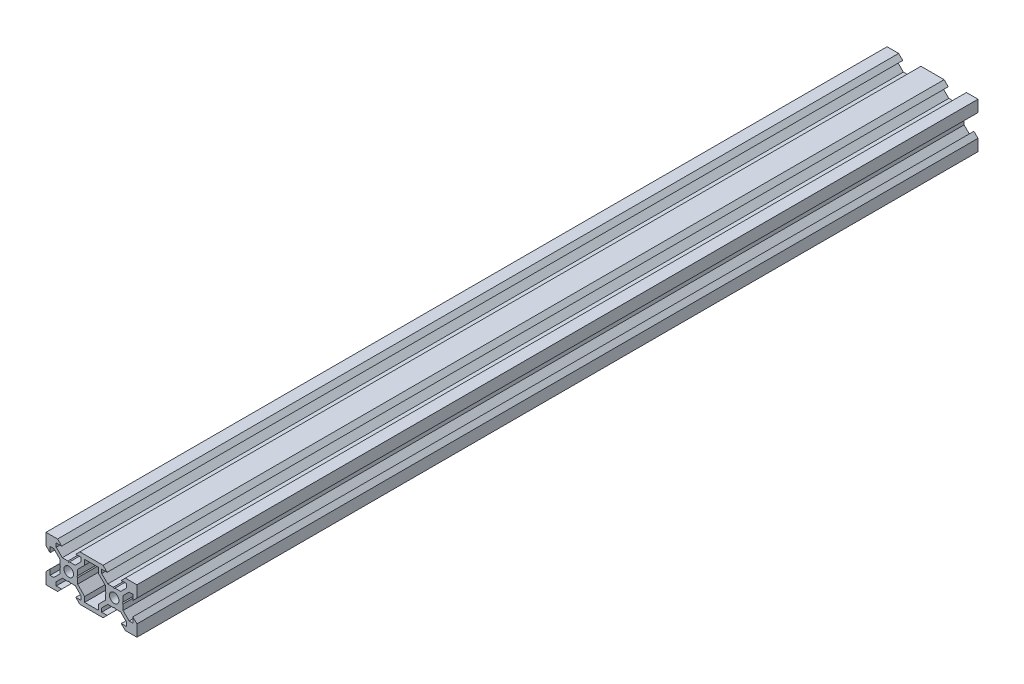
from build123d import *

# Parameters (mm, degrees)
SKETCH_1_W               = 40
SKETCH_1_H               = 20
EXTRUDE_1_DEPTH          = 370
SKETCH_2_R               = 2.1
CUT_EXTRUDE_1_DEPTH      = 371.675059857
CUT_EXTRUDE_2_DEPTH      = 371.675059857
PATTERN_CIRCULAR_1_COUNT = 4
MIRROR_1_COPY_1_DEPTH    = 371.675059857
MIRROR_1_COPY_2_DEPTH    = 371.675059857
MIRROR_1_COPY_3_DEPTH    = 371.675059857
CUT_EXTRUDE_3_DEPTH      = 371.675059857


with BuildPart() as part:
    # 草图1 → 凸台-拉伸1 (new body)
    with BuildSketch(Plane.XY):
        Rectangle(SKETCH_1_W, SKETCH_1_H)
    extrude(amount=-EXTRUDE_1_DEPTH)

    # 草图2 → 切除-拉伸1 (cut, through all)
    with BuildSketch(Plane.XY):
        with Locations((-10, 0)):
            Circle(SKETCH_2_R)
        with Locations(Location((10, 0, 0), (0, 0, 180))):
            Circle(SKETCH_2_R)
    extrude(amount=-CUT_EXTRUDE_1_DEPTH, mode=Mode.SUBTRACT)

    # 草图3 → 切除-拉伸2 (cut, through all)
    with BuildSketch(Plane.XY):
        Polygon((16.56, 5.499339828), (13.900660172, 2.84), (13.900660172, 0.353553391), (13.547106781, 0), (13.900660172, -0.353553391), (13.900660172, -2.84), (16.56, -5.499339828), (18.2, -5.499339828), (18.2, -3.1), (20, -4.9), (20, 4.9), (18.2, 3.1), (18.2, 5.499339828), align=None)
    cut_extrude_2 = extrude(amount=-CUT_EXTRUDE_2_DEPTH, mode=Mode.SUBTRACT)

    # 阵列(圆周)1: 切除-拉伸2 ×4 about axis
    pattern_circular_1_axis = Axis((10, 0, 0), (0, 0, 1))
    for i in range(1, PATTERN_CIRCULAR_1_COUNT):
        add(cut_extrude_2.rotate(pattern_circular_1_axis, i * 360 / PATTERN_CIRCULAR_1_COUNT), mode=Mode.SUBTRACT)

    # 镜向1: 切除-拉伸2 across plane
    add(cut_extrude_2.mirror(Plane(origin=(0, 0, 0), x_dir=(0, 0, 1), z_dir=(1, 0, 0))), mode=Mode.SUBTRACT)

    # 镜向1 copy 1 sketch → 镜向1 copy 1 (cut, through all)
    with BuildSketch(Plane(origin=(-10, -10, 0), x_dir=(0, 1, 0), z_dir=(0, 0, 1))):
        Polygon((16.56, -5.499339828), (13.900660172, -2.84), (13.900660172, -0.353553391), (13.547106781, 0), (13.900660172, 0.353553391), (13.900660172, 2.84), (16.56, 5.499339828), (18.2, 5.499339828), (18.2, 3.1), (20, 4.9), (20, -4.9), (18.2, -3.1), (18.2, -5.499339828), align=None)
    extrude(amount=-MIRROR_1_COPY_1_DEPTH, mode=Mode.SUBTRACT)

    # 镜向1 copy 2 sketch → 镜向1 copy 2 (cut, through all)
    with BuildSketch(Plane(origin=(-20, 0, 0), x_dir=(1, 0, 0), z_dir=(0, 0, 1))):
        Polygon((16.56, -5.499339828), (13.900660172, -2.84), (13.900660172, -0.353553391), (13.547106781, 0), (13.900660172, 0.353553391), (13.900660172, 2.84), (16.56, 5.499339828), (18.2, 5.499339828), (18.2, 3.1), (20, 4.9), (20, -4.9), (18.2, -3.1), (18.2, -5.499339828), align=None)
    extrude(amount=-MIRROR_1_COPY_2_DEPTH, mode=Mode.SUBTRACT)

    # 镜向1 copy 3 sketch → 镜向1 copy 3 (cut, through all)
    with BuildSketch(Plane(origin=(-10, 10, 0), x_dir=(0, -1, 0), z_dir=(0, 0, 1))):
        Polygon((16.56, -5.499339828), (13.900660172, -2.84), (13.900660172, -0.353553391), (13.547106781, 0), (13.900660172, 0.353553391), (13.900660172, 2.84), (16.56, 5.499339828), (18.2, 5.499339828), (18.2, 3.1), (20, 4.9), (20, -4.9), (18.2, -3.1), (18.2, -5.499339828), align=None)
    extrude(amount=-MIRROR_1_COPY_3_DEPTH, mode=Mode.SUBTRACT)

    # 草图4 → 切除-拉伸3 (cut, through all)
    with BuildSketch(Plane.XY):
        Polygon((-3.000660172, -8.2), (3.000660172, -8.2), (3.000660172, -5.938679656), (6.099339828, -2.84), (6.099339828, 2.84), (3.000660172, 5.938679656), (3.000660172, 8.2), (-3.000660172, 8.2), (-3.000660172, 5.938679656), (-6.099339828, 2.84), (-6.099339828, -2.84), (-3.000660172, -5.938679656), align=None)
    extrude(amount=-CUT_EXTRUDE_3_DEPTH, mode=Mode.SUBTRACT)


solid = part.part
